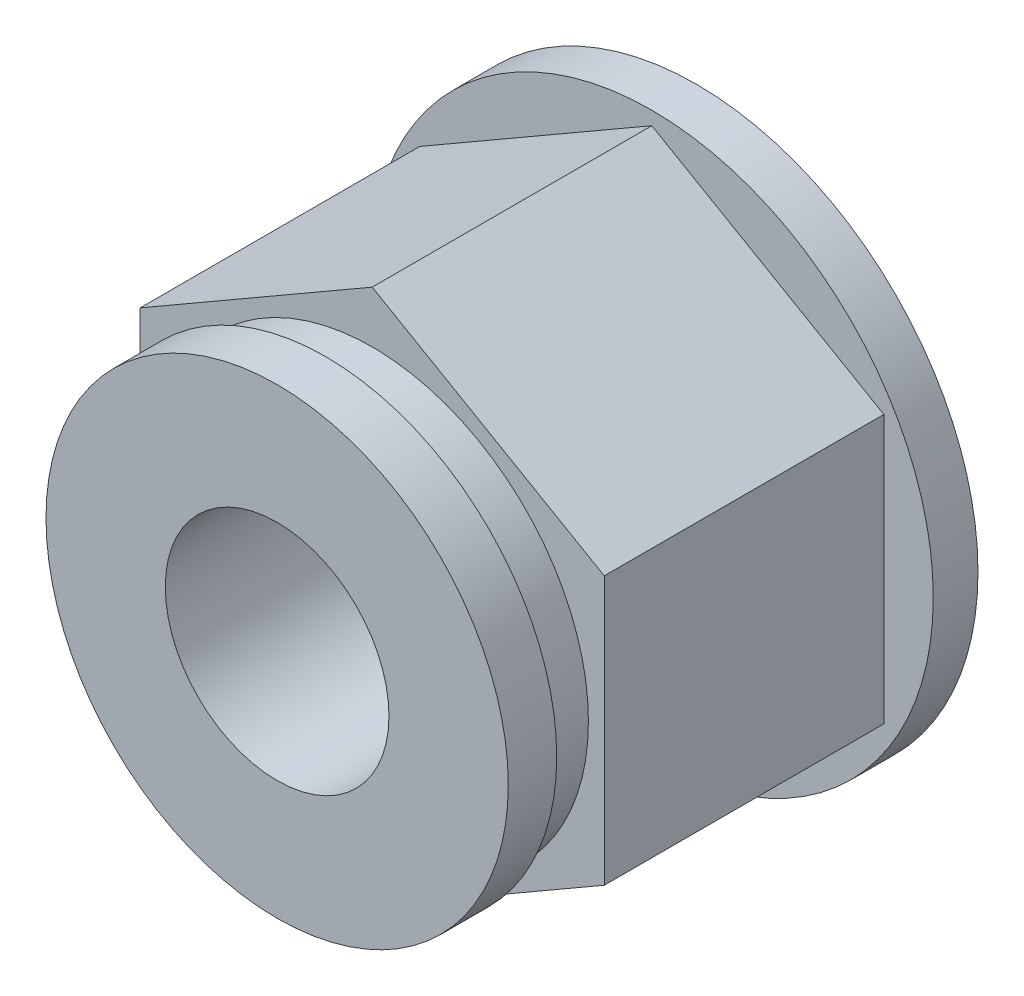
from build123d import *

# Parameters (mm, degrees)
ESQUISSE1_R             = 7.55
BOSS_EXTRU_1_DEPTH      = 1.2
BOSS_EXTRU_2_DEPTH      = 7.5
ESQUISSE3_R             = 5.8
BOSS_EXTRU_3_DEPTH      = 1.25
ESQUISSE4_R             = 6.2
BOSS_EXTRU_4_DEPTH      = 1.3
ESQUISSE5_R             = 3
ENL_V_MAT_EXTRU_1_DEPTH = 16.510238554


with BuildPart() as part:
    # Esquisse1 → Boss.-Extru.1 (new body)
    with BuildSketch(Plane.XY):
        Circle(ESQUISSE1_R)
    extrude(amount=BOSS_EXTRU_1_DEPTH)

    # Esquisse2 → Boss.-Extru.2 (add)
    with BuildSketch(Plane.XY.offset(1.2)):
        Polygon((6.225, -3.594005426), (6.225, 3.594005426), (0, 7.188010851), (-6.225, 3.594005426), (-6.225, -3.594005426), (0, -7.188010851), align=None)
    extrude(amount=BOSS_EXTRU_2_DEPTH)

    # Esquisse3 → Boss.-Extru.3 (add)
    with BuildSketch(Plane.XY.offset(8.7)):
        Circle(ESQUISSE3_R)
    extrude(amount=BOSS_EXTRU_3_DEPTH)

    # Esquisse4 → Boss.-Extru.4 (add)
    with BuildSketch(Plane.XY.offset(9.95)):
        Circle(ESQUISSE4_R)
    extrude(amount=BOSS_EXTRU_4_DEPTH)

    # Esquisse5 → Enlèv. mat.-Extru.1 (cut, through all)
    with BuildSketch(Plane.XY.offset(11.25)):
        Circle(ESQUISSE5_R)
    extrude(amount=-ENL_V_MAT_EXTRU_1_DEPTH, mode=Mode.SUBTRACT)


solid = part.part
